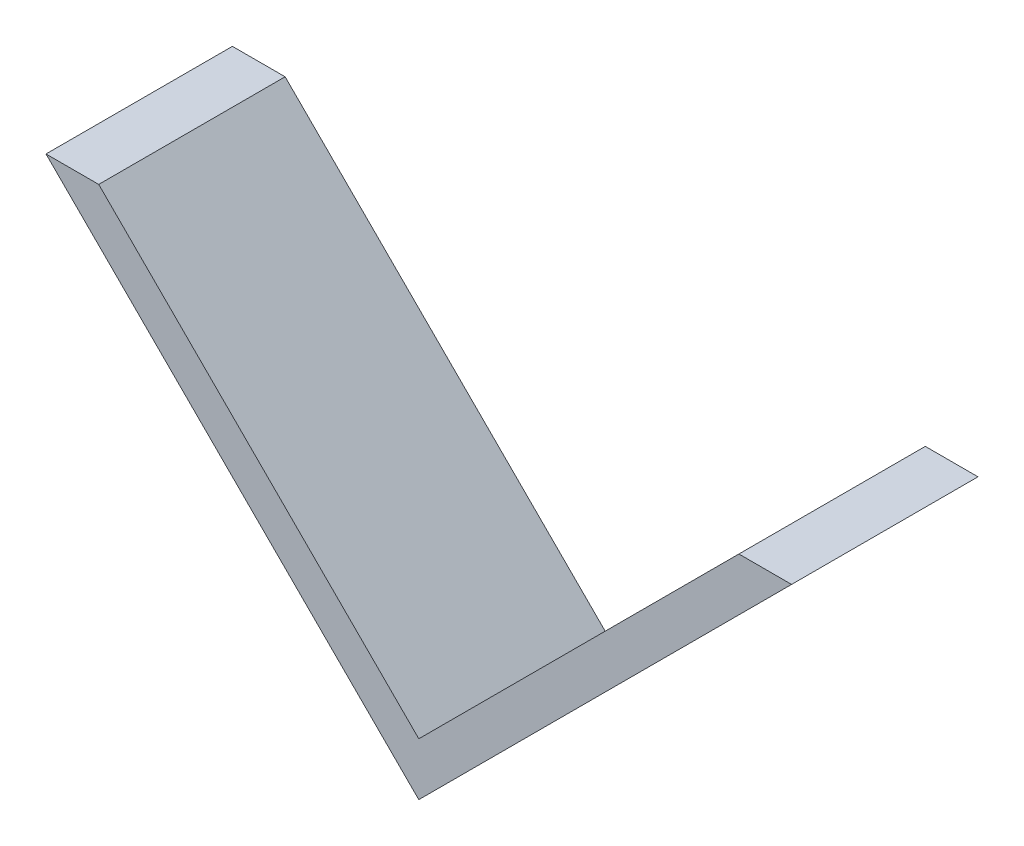
from build123d import *

# Parameters (mm, degrees)
BOSS_EXTRUDE1_DEPTH = 5
CUT_EXTRUDE1_DEPTH  = 10


with BuildPart() as part:
    # Sketch1 → Boss-Extrude1 (new, symmetric)
    with BuildSketch(Plane.XY):
        Polygon((0, 0), (20, 20), (-20, 20), align=None)
    extrude(amount=BOSS_EXTRUDE1_DEPTH, both=True)

    # Sketch2 → Cut-Extrude1 (cut)
    with BuildSketch(Plane.XY.offset(5)):
        Polygon((0, 2.828427125), (-17.171572875, 20), (17.171572875, 20), align=None)
    extrude(amount=-CUT_EXTRUDE1_DEPTH, mode=Mode.SUBTRACT)


solid = part.part
